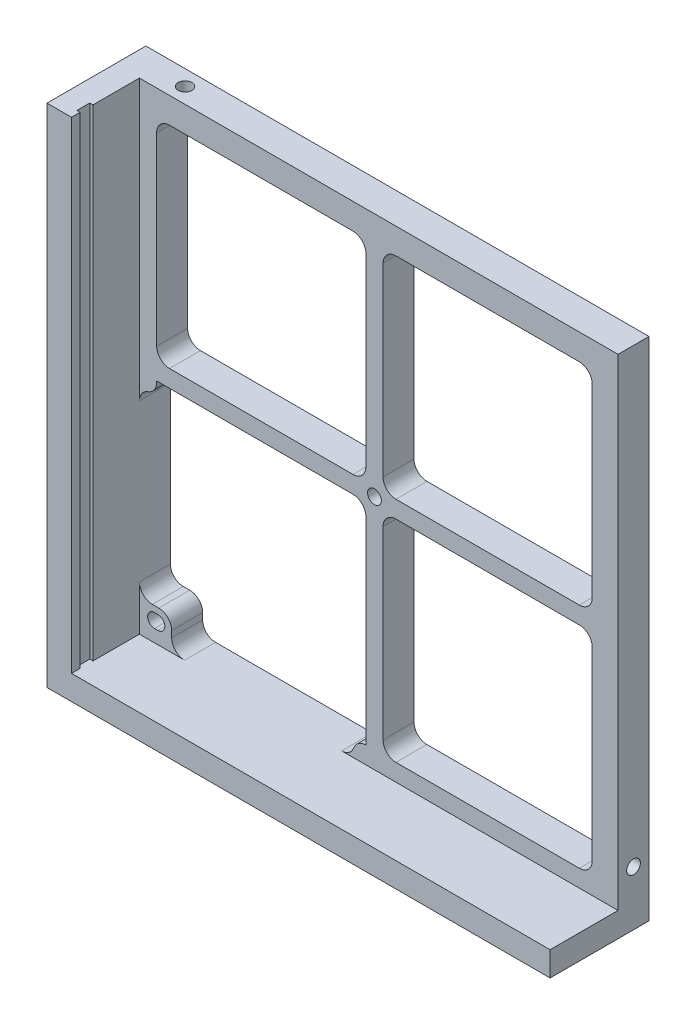
from build123d import *

# Parameters (mm, degrees)
BOSS_EXTRUDE1_DEPTH            = 23
SKETCH2_W                      = 3
SKETCH2_H                      = 112
CUT_EXTRUDE1_DEPTH             = 0.75
SKETCH3_W                      = 7.2
SKETCH3_H                      = 6
BOSS_EXTRUDE2_DEPTH            = 10
SKETCH3_3_W                    = 7.2
SKETCH3_3_H                    = 106
BOSS_EXTRUDE3_DEPTH            = 4
FILLET1_R                      = 3
SKETCH5_W                      = 101.3
SKETCH5_H                      = 7.2
BOSS_EXTRUDE4_DEPTH            = 4
SKETCH5_3_W                    = 6
SKETCH5_3_H                    = 7.2
BOSS_EXTRUDE5_DEPTH            = 10
FILLET3_R                      = 3
SKETCH6_W                      = 50
SKETCH6_H                      = 50
CUT_EXTRUDE2_DEPTH             = 167.709117927
FILLET8_R                      = 3
FILLET9_R                      = 3
FILLET10_R                     = 3
FILLET11_R                     = 3
CUT_EXTRUDE3_REACH             = 169.545
SKETCH7_R                      = 1
CUT_EXTRUDE3_DIRECTION_2_DEPTH = 168.544889647
SKETCH7_5_R                    = 1.6
SKETCH7_5_R_2                  = 1
CUT_EXTRUDE4_DEPTH             = 3.2
CUT_EXTRUDE6_START             = -5.5
SKETCH8_R                      = 2
CUT_EXTRUDE6_DEPTH             = 3
CUT_EXTRUDE7_REACH             = 169.545
SKETCH9_R                      = 1
SKETCH9_3_R                    = 1.6
SKETCH9_3_R_2                  = 1
CUT_EXTRUDE8_DEPTH             = 3.2
CUT_EXTRUDE9_START             = -5.5
SKETCH10_R                     = 2
CUT_EXTRUDE9_DEPTH             = 3.2
BOSS_EXTRUDE6_DEPTH            = 7.2
FILLET12_R                     = 3
BOSS_EXTRUDE7_DEPTH            = 7.2
FILLET13_R                     = 3
FILLET14_R                     = 3
FILLET15_R                     = 3
FILLET16_R                     = 3
BOSS_EXTRUDE8_DEPTH            = 7.2
CUT_EXTRUDE10_REACH            = 168.709
CUT_EXTRUDE11_DEPTH            = 7.2
FILLET17_R                     = 3
CUT_EXTRUDE12_REACH            = 169.545
SKETCH16_R                     = 1.6


with BuildPart() as part:
    # Sketch1 → Boss-Extrude1 (new body)
    with BuildSketch(Plane.XY):
        Polygon((0, 117.7), (0, 0), (117, 0), (117, 5.7), (5.7, 5.7), (5.7, 117.7), align=None)
    extrude(amount=BOSS_EXTRUDE1_DEPTH)

    # Sketch2 → Cut-Extrude1 (cut)
    with BuildSketch(Plane(origin=(5.7, 0, 0), x_dir=(0, 0, -1), z_dir=(1, 0, 0))):
        with Locations((-19.5, 61.7)):
            Rectangle(SKETCH2_W, SKETCH2_H)
    extrude(amount=-CUT_EXTRUDE1_DEPTH, mode=Mode.SUBTRACT)

    # Sketch3 → Boss-Extrude2 (add)
    with BuildSketch(Plane(origin=(5.7, 0, 0), x_dir=(0, 0, -1), z_dir=(1, 0, 0))):
        with Locations((-3.6, 114.7)):
            Rectangle(SKETCH3_W, SKETCH3_H)
    extrude(amount=BOSS_EXTRUDE2_DEPTH)

    # Sketch3<3> → Boss-Extrude3 (add)
    with BuildSketch(Plane(origin=(5.7, 0, 0), x_dir=(0, 0, -1), z_dir=(1, 0, 0))):
        with Locations((-3.6, 58.7)):
            Rectangle(SKETCH3_3_W, SKETCH3_3_H)
    extrude(amount=BOSS_EXTRUDE3_DEPTH)

    # Fillet1
    fillet1_edges = [part.edges().sort_by_distance(p)[0] for p in [
        (9.7, 111.7, 3.6),
    ]]
    fillet(fillet1_edges, radius=FILLET1_R)

    # Sketch5 → Boss-Extrude4 (add)
    with BuildSketch(Plane(origin=(0, 5.7, 0), x_dir=(1, 0, 0), z_dir=(0, 1, 0))):
        with Locations((60.35, -3.6)):
            Rectangle(SKETCH5_W, SKETCH5_H)
    extrude(amount=BOSS_EXTRUDE4_DEPTH)

    # Sketch5<3> → Boss-Extrude5 (add)
    with BuildSketch(Plane(origin=(0, 5.7, 0), x_dir=(1, 0, 0), z_dir=(0, 1, 0))):
        with Locations((114, -3.6)):
            Rectangle(SKETCH5_3_W, SKETCH5_3_H)
    extrude(amount=BOSS_EXTRUDE5_DEPTH)

    # Fillet3
    fillet3_edges = [part.edges().sort_by_distance(p)[0] for p in [
        (111, 9.7, 3.6),
    ]]
    fillet(fillet3_edges, radius=FILLET3_R)

    # Sketch6 → Cut-Extrude2 (cut, through all)
    with BuildSketch(Plane.XY.offset(7.2)):
        with Locations((30.7, 30.7)):
            Rectangle(SKETCH6_W, SKETCH6_H)
    extrude(amount=-CUT_EXTRUDE2_DEPTH, mode=Mode.SUBTRACT)

    # Fillet8
    fillet8_edges = [part.edges().sort_by_distance(p)[0] for p in [
        (5.7, 55.7, 3.6),
    ]]
    fillet(fillet8_edges, radius=FILLET8_R)

    # Fillet9
    fillet9_edges = [part.edges().sort_by_distance(p)[0] for p in [
        (9.7, 55.7, 3.6),
    ]]
    fillet(fillet9_edges, radius=FILLET9_R)

    # Fillet10
    fillet10_edges = [part.edges().sort_by_distance(p)[0] for p in [
        (55.7, 5.7, 3.6),
    ]]
    fillet(fillet10_edges, radius=FILLET10_R)

    # Fillet11
    fillet11_edges = [part.edges().sort_by_distance(p)[0] for p in [
        (55.7, 9.7, 3.6),
    ]]
    fillet(fillet11_edges, radius=FILLET11_R)

    # Sketch7 → Cut-Extrude3 (cut, up to next)
    with BuildSketch(Plane(origin=(117, 0, 0), x_dir=(0, 0, -1), z_dir=(1, 0, 0)), mode=Mode.PRIVATE) as cut_extrude3_sk1:
        with Locations(Location((-3.6, 12.7, 0), (0, 0, 180))):
            Circle(SKETCH7_R)
    cut_extrude3_tool1 = extrude(cut_extrude3_sk1.sketch, amount=-CUT_EXTRUDE3_REACH, mode=Mode.PRIVATE) & part.part
    add(cut_extrude3_tool1.solids().sort_by_distance((117, 12.7, 3.6))[0], mode=Mode.SUBTRACT)

    # Sketch7 → Cut-Extrude3 direction 2 (cut)
    with BuildSketch(Plane(origin=(117, 0, 0), x_dir=(0, 0, -1), z_dir=(1, 0, 0))):
        with Locations(Location((-3.6, 12.7, 0), (0, 0, 180))):
            Circle(SKETCH7_R)
    extrude(amount=CUT_EXTRUDE3_DIRECTION_2_DEPTH, mode=Mode.SUBTRACT)

    # Sketch7<5> → Cut-Extrude4 (cut)
    with BuildSketch(Plane(origin=(117, 0, 0), x_dir=(0, 0, -1), z_dir=(1, 0, 0))):
        with Locations((-3.6, 12.7)):
            Circle(SKETCH7_5_R)
        with Locations((-3.6, 12.7)):
            Circle(SKETCH7_5_R_2, mode=Mode.SUBTRACT)
    extrude(amount=-CUT_EXTRUDE4_DEPTH, mode=Mode.SUBTRACT)

    # Sketch8 → Cut-Extrude6 (cut)
    with BuildSketch(Plane(origin=(117, 0, 0), x_dir=(0, 0, -1), z_dir=(1, 0, 0)).offset(CUT_EXTRUDE6_START)):
        with Locations((-3.6, 12.7)):
            Circle(SKETCH8_R)
    extrude(amount=-CUT_EXTRUDE6_DEPTH, mode=Mode.SUBTRACT)

    # Sketch9 → Cut-Extrude7 (cut, up to next)
    with BuildSketch(Plane(origin=(0, 117.7, 0), x_dir=(1, 0, 0), z_dir=(0, 1, 0)), mode=Mode.PRIVATE) as cut_extrude7_sk1:
        with Locations(Location((12.7, -3.6, 0), (0, 0, 270))):
            Circle(SKETCH9_R)
    cut_extrude7_tool1 = extrude(cut_extrude7_sk1.sketch, amount=-CUT_EXTRUDE7_REACH, mode=Mode.PRIVATE) & part.part
    add(cut_extrude7_tool1.solids().sort_by_distance((12.7, 117.7, 3.6))[0], mode=Mode.SUBTRACT)

    # Sketch9<3> → Cut-Extrude8 (cut)
    with BuildSketch(Plane(origin=(0, 117.7, 0), x_dir=(1, 0, 0), z_dir=(0, 1, 0))):
        with Locations(Location((12.7, -3.6, 0), (0, 0, 270))):
            Circle(SKETCH9_3_R)
        with Locations(Location((12.7, -3.6, 0), (0, 0, 270))):
            Circle(SKETCH9_3_R_2, mode=Mode.SUBTRACT)
    extrude(amount=-CUT_EXTRUDE8_DEPTH, mode=Mode.SUBTRACT)

    # Sketch10 → Cut-Extrude9 (cut)
    with BuildSketch(Plane(origin=(0, 117.7, 0), x_dir=(1, 0, 0), z_dir=(0, 1, 0)).offset(CUT_EXTRUDE9_START)):
        with Locations(Location((12.7, -3.6, 0), (0, 0, 270))):
            Circle(SKETCH10_R)
    extrude(amount=-CUT_EXTRUDE9_DEPTH, mode=Mode.SUBTRACT)

    # Sketch11 → Boss-Extrude6 (add)
    with BuildSketch(Plane(origin=(0, 0, 0), x_dir=(-1, 0, 0), z_dir=(0, 0, -1))):
        Polygon((-117, 15.7), (-111, 15.7), (-111, 111.7), (-15.7, 111.7), (-15.7, 117.7), (-63.35, 117.7), (-117, 117.7), align=None)
    extrude(amount=-BOSS_EXTRUDE6_DEPTH)

    # Fillet12
    fillet12_edges = [part.edges().sort_by_distance(p)[0] for p in [
        (111, 111.7, 3.6),
    ]]
    fillet(fillet12_edges, radius=FILLET12_R)

    # Sketch12 → Boss-Extrude7 (add)
    with BuildSketch(Plane(origin=(0, 0, 0), x_dir=(-1, 0, 0), z_dir=(0, 0, -1))):
        Polygon((-62.35, 12.7), (-62.35, 9.7), (-58.356854249, 9.7), (-58.35, 12.7), (-58.35, 58.7), (-9.7, 58.7), (-9.7, 62.7), (-58.35, 62.7), (-58.35, 108.7), (-58.35, 111.7), (-62.35, 111.7), (-62.35, 108.7), (-62.35, 62.7), (-111, 62.7), (-111, 58.7), (-62.35, 58.7), align=None)
    extrude(amount=-BOSS_EXTRUDE7_DEPTH)

    # Fillet13
    fillet13_edges = [part.edges().sort_by_distance(p)[0] for p in [
        (111, 62.7, 3.6),
        (62.35, 62.7, 3.6),
        (62.35, 111.7, 3.6),
    ]]
    fillet(fillet13_edges, radius=FILLET13_R)

    # Fillet14
    fillet14_edges = [part.edges().sort_by_distance(p)[0] for p in [
        (111, 58.7, 3.6),
        (62.35, 9.7, 3.6),
        (62.35, 58.7, 3.6),
    ]]
    fillet(fillet14_edges, radius=FILLET14_R)

    # Fillet15
    fillet15_edges = [part.edges().sort_by_distance(p)[0] for p in [
        (58.35, 111.7, 3.6),
        (58.35, 62.7, 3.6),
        (9.7, 62.7, 3.6),
    ]]
    fillet(fillet15_edges, radius=FILLET15_R)

    # Fillet16
    fillet16_edges = [part.edges().sort_by_distance(p)[0] for p in [
        (58.35, 58.7, 3.6),
    ]]
    fillet(fillet16_edges, radius=FILLET16_R)

    # Sketch13 → Boss-Extrude8 (add)
    with BuildSketch(Plane(origin=(0, 0, 0), x_dir=(-1, 0, 0), z_dir=(0, 0, -1))):
        Polygon((-5.7, 20.7), (-20.7, 5.7), (-5.7, 5.7), align=None)
    extrude(amount=-BOSS_EXTRUDE8_DEPTH)

    # Sketch14 → Cut-Extrude10 (cut, up to next)
    with BuildSketch(Plane.XY.offset(7.2), mode=Mode.PRIVATE) as cut_extrude10_sk1:
        with BuildLine():
            Line((10, 8.6), (9.2, 8.6))
            ThreePointArc((9.2, 8.6), (7.6, 10.2), (9.2, 11.8))
            Line((9.2, 11.8), (10, 11.8))
            ThreePointArc((10, 11.8), (11.6, 10.2), (10, 8.6))
        make_face()
    cut_extrude10_tool1 = extrude(cut_extrude10_sk1.sketch, amount=-CUT_EXTRUDE10_REACH, mode=Mode.PRIVATE) & part.part
    add(cut_extrude10_tool1.solids().sort_by_distance((9.6, 10.2, 7.2))[0], mode=Mode.SUBTRACT)

    # Sketch15 → Cut-Extrude11 (cut)
    with BuildSketch(Plane.XY.offset(7.2)):
        Polygon((13.2, 5.7), (20.7, 5.7), (13.2, 13.2), align=None)
        Polygon((5.7, 13.2), (13.2, 13.2), (5.7, 20.7), align=None)
        Polygon((13.2, 13.2), (20.7, 5.7), (20.7, 13.2), (20.7, 20.7), (13.2, 20.7), (5.7, 20.7), align=None)
    extrude(amount=-CUT_EXTRUDE11_DEPTH, mode=Mode.SUBTRACT)

    # Fillet17
    fillet17_edges = [part.edges().sort_by_distance(p)[0] for p in [
        (5.7, 13.2, 3.6),
        (13.2, 5.7, 3.6),
        (13.2, 13.2, 3.6),
    ]]
    fillet(fillet17_edges, radius=FILLET17_R)

    # Sketch16 → Cut-Extrude12 (cut, up to next)
    with BuildSketch(Plane(origin=(0, 0, 0), x_dir=(-1, 0, 0), z_dir=(0, 0, -1)), mode=Mode.PRIVATE) as cut_extrude12_sk1:
        with Locations((-60.35, 60.7)):
            Circle(SKETCH16_R)
    cut_extrude12_tool1 = extrude(cut_extrude12_sk1.sketch, amount=-CUT_EXTRUDE12_REACH, mode=Mode.PRIVATE) & part.part
    add(cut_extrude12_tool1.solids().sort_by_distance((60.35, 60.7, 0))[0], mode=Mode.SUBTRACT)


solid = part.part
